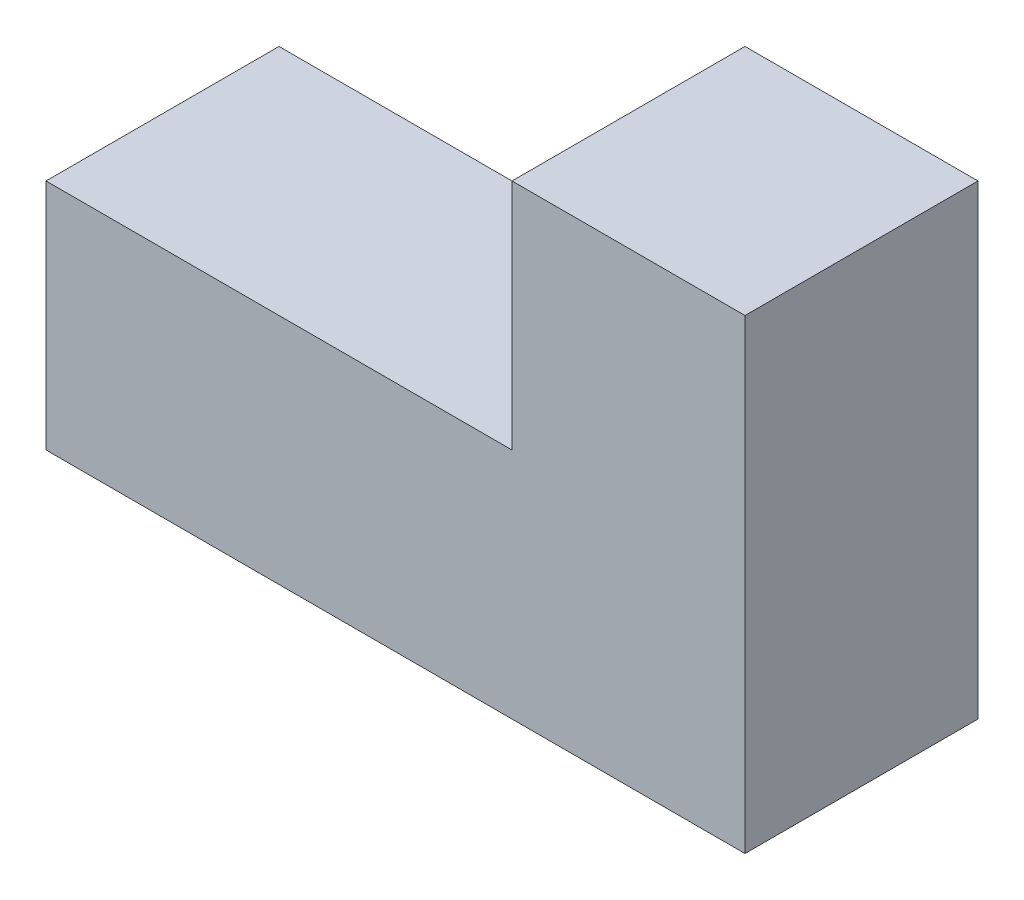
from build123d import *

# Parameters (mm, degrees)
BOSS_EXTRU_1_DEPTH = 300


with BuildPart() as part:
    # Esquisse1 → Boss.-Extru.1 (new body)
    with BuildSketch(Plane.XY):
        Polygon((0, 0), (900, 0), (900, 600), (600, 600), (600, 300), (0, 300), align=None)
    extrude(amount=BOSS_EXTRU_1_DEPTH)


solid = part.part
